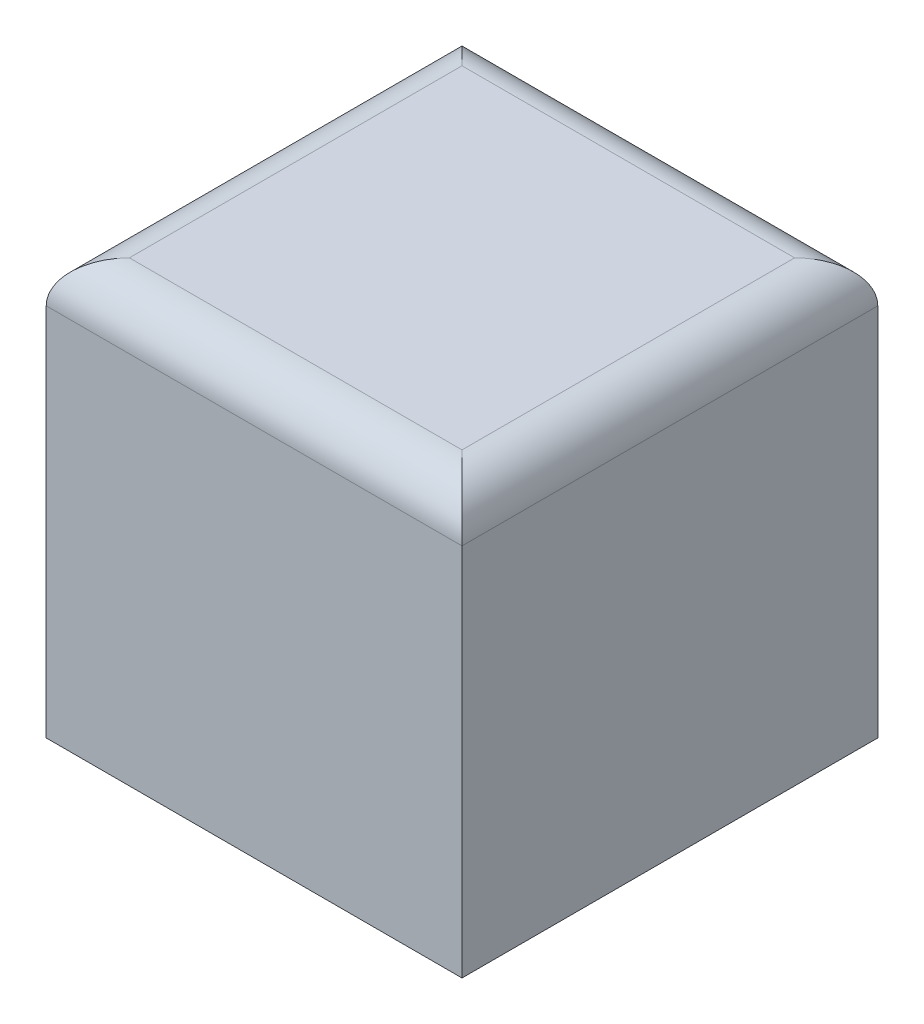
from build123d import *

# Parameters (mm, degrees)
SKETCH_1_W      = 100
SKETCH_1_H      = 100
EXTRUDE_1_DEPTH = 100
FILLET_1_R      = 10


with BuildPart() as part:
    # 草图1 → 凸台-拉伸1 (new body)
    with BuildSketch(Plane.XY):
        Rectangle(SKETCH_1_W, SKETCH_1_H)
    extrude(amount=EXTRUDE_1_DEPTH)

    # 圆角1
    fillet_1_edges = [part.edges().sort_by_distance(p)[0] for p in [
        (0, 50, 0),
        (-50, 50, 50),
        (50, 50, 50),
        (0, 50, 100),
    ]]
    fillet(fillet_1_edges, radius=FILLET_1_R)


solid = part.part
